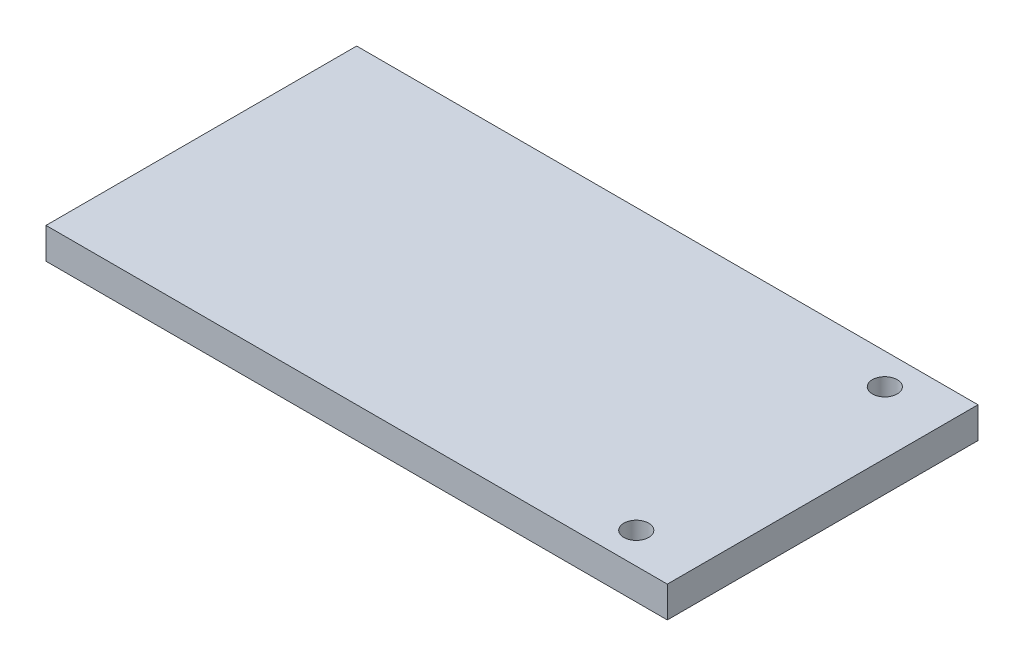
from build123d import *

# Parameters (mm, degrees)
SKETCH_1_W      = 100
SKETCH_1_H      = 50
SKETCH_1_R      = 2
EXTRUDE_1_DEPTH = 5


with BuildPart() as part:
    # 草图1 → 凸台-拉伸1 (new body)
    with BuildSketch(Plane(origin=(0, 0, 0), x_dir=(1, 0, 0), z_dir=(0, 1, 0))):
        Rectangle(SKETCH_1_W, SKETCH_1_H)
        with Locations(Location((40, 20, 0), (0, 0, 270))):
            Circle(SKETCH_1_R, mode=Mode.SUBTRACT)
        with Locations(Location((40, -20, 0), (0, 0, 270))):
            Circle(SKETCH_1_R, mode=Mode.SUBTRACT)
    extrude(amount=EXTRUDE_1_DEPTH)


solid = part.part
